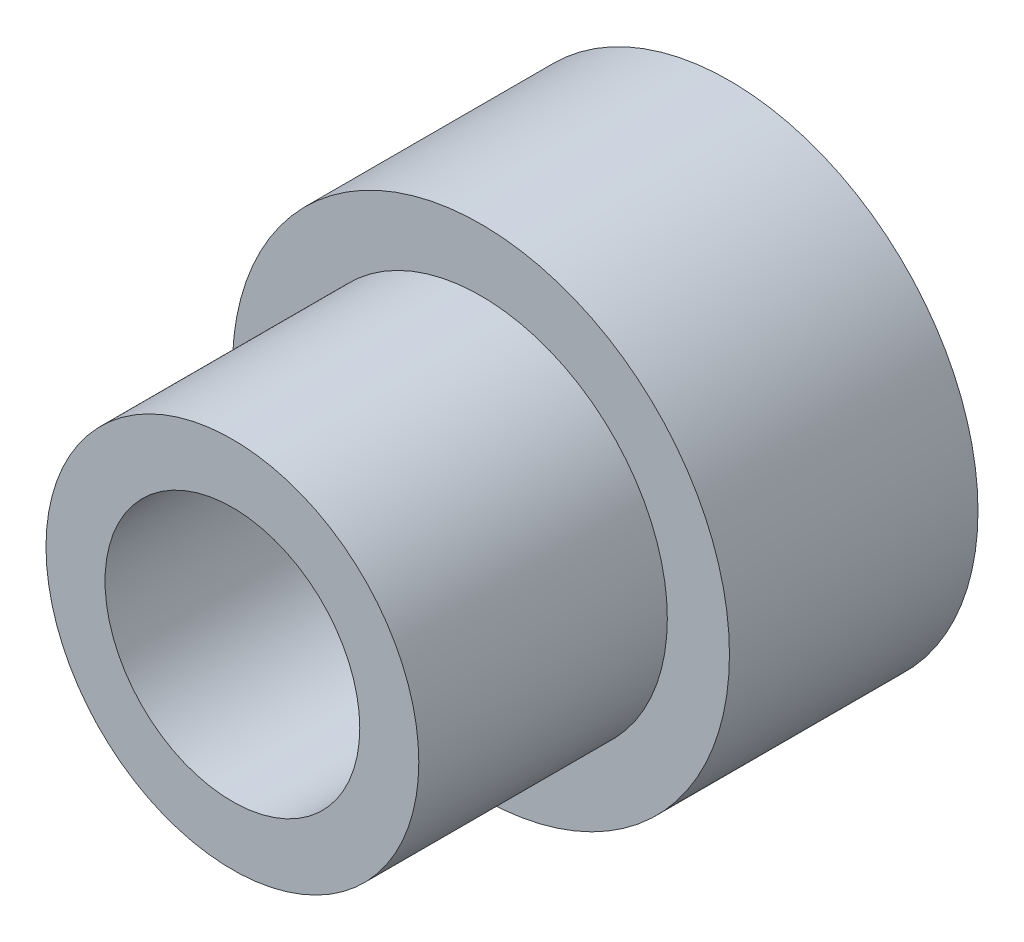
from build123d import *

# Parameters (mm, degrees)
CROQUIS1_R              = 2
SALIENTE_EXTRUIR1_DEPTH = 2
CROQUIS2_R              = 1.5
CROQUIS2_R_2            = 1.025
SALIENTE_EXTRUIR2_DEPTH = 2
CHAFL_N1_SIZE           = 0.2


with BuildPart() as part:
    # Croquis1 → Saliente-Extruir1 (new body)
    with BuildSketch(Plane.XY):
        Circle(CROQUIS1_R)
    extrude(amount=SALIENTE_EXTRUIR1_DEPTH)

    # Croquis2 → Saliente-Extruir2 (add)
    with BuildSketch(Plane.XY.offset(2)):
        Circle(CROQUIS2_R)
        Circle(CROQUIS2_R_2, mode=Mode.SUBTRACT)
    extrude(amount=SALIENTE_EXTRUIR2_DEPTH)

    # Chaflán1
    chafl_n1_edges = [part.edges().sort_by_distance(p)[0] for p in [
        (-1.025, 0, 2),
    ]]
    chamfer(chafl_n1_edges, length=CHAFL_N1_SIZE)


solid = part.part
